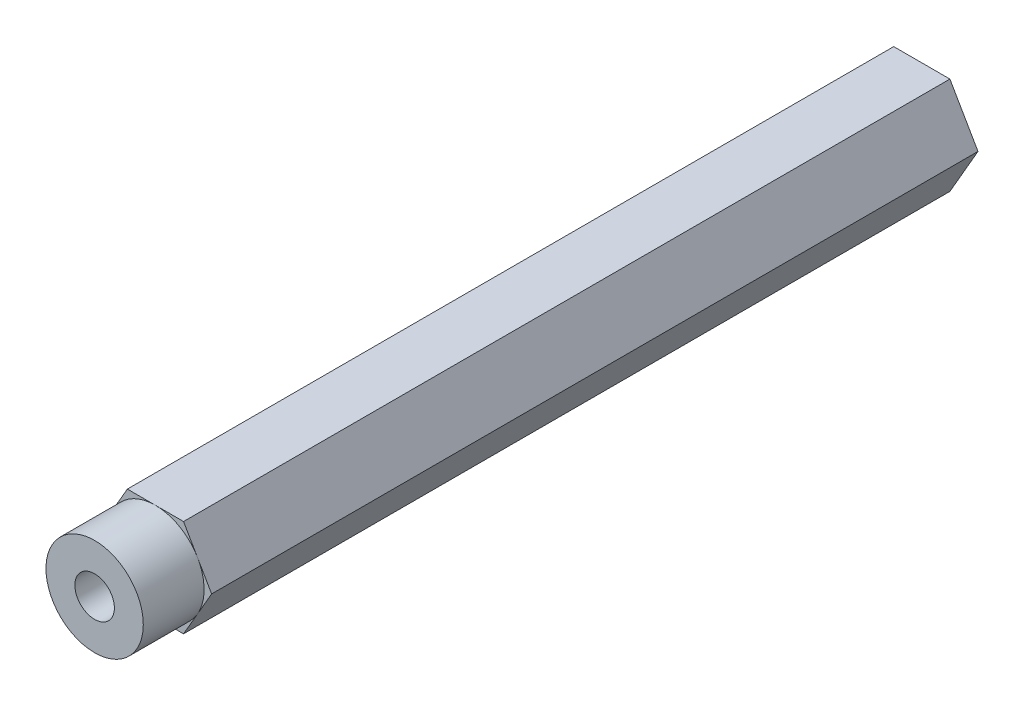
from build123d import *

# Parameters (mm, degrees)
SKETCH1_R           = 2.5796875
BOSS_EXTRUDE1_DEPTH = 100.0125
SKETCH2_R           = 6.35
SKETCH2_R_2         = 2.5796875
BOSS_EXTRUDE2_DEPTH = 7.9375


with BuildPart() as part:
    # Sketch1 → Boss-Extrude1 (new body)
    with BuildSketch(Plane.XY):
        Polygon((7.332348419, 0), (3.666174209, 6.35), (-3.666174209, 6.35), (-7.332348419, 0), (-3.666174209, -6.35), (3.666174209, -6.35), align=None)
        with Locations(Location((0, 0, 0), (0, 0, 180))):
            Circle(SKETCH1_R, mode=Mode.SUBTRACT)
    extrude(amount=BOSS_EXTRUDE1_DEPTH)

    # Sketch2 → Boss-Extrude2 (add)
    with BuildSketch(Plane.XY.offset(100.0125)):
        with Locations(Location((0, 0, 0), (0, 0, 150))):
            Circle(SKETCH2_R)
        with Locations(Location((0, 0, 0), (0, 0, 180))):
            Circle(SKETCH2_R_2, mode=Mode.SUBTRACT)
    extrude(amount=BOSS_EXTRUDE2_DEPTH)


solid = part.part
